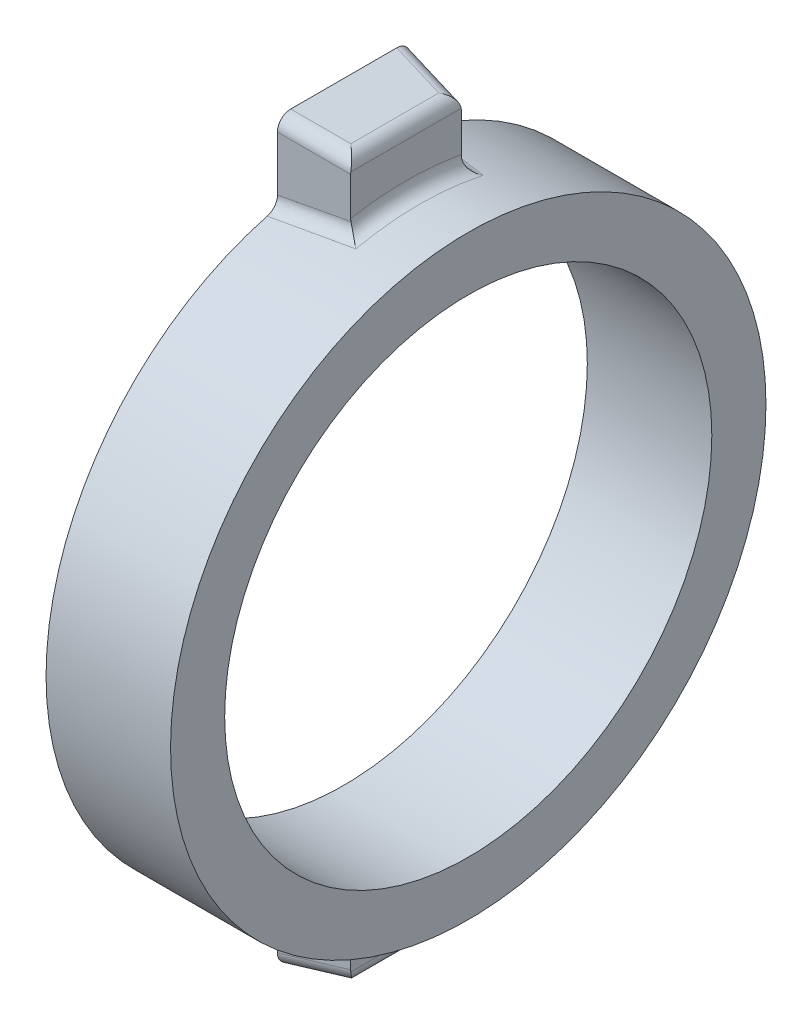
from build123d import *

# Parameters (mm, degrees)
SKETCH1_R                     = 11
SKETCH1_R_2                   = 9
BOSS_EXTRUDE1_DEPTH           = 4.6
SKETCH1_3_R                   = 11
SKETCH1_3_R_2                 = 9
BOSS_EXTRUDE2_DEPTH           = 4.6
BOSS_EXTRUDE3_DEPTH           = 2.3
BOSS_EXTRUDE3_DRAFT           = -10
BOSS_EXTRUDE3_PROFILE_2_DEPTH = 2.3
BOSS_EXTRUDE3_PROFILE_2_DRAFT = -10
FILLET1_R                     = 0.5


with BuildPart() as part:
    # Sketch1 → Boss-Extrude1 (new body)
    with BuildSketch(Plane.YZ):
        Circle(SKETCH1_R)
        Circle(SKETCH1_R_2, mode=Mode.SUBTRACT)
    extrude(amount=BOSS_EXTRUDE1_DEPTH)

    # Sketch1<3> → Boss-Extrude2 (add)
    with BuildSketch(Plane.YZ):
        Circle(SKETCH1_3_R)
        Circle(SKETCH1_3_R_2, mode=Mode.SUBTRACT)
    extrude(amount=BOSS_EXTRUDE2_DEPTH)


with BuildPart() as boss_extrude3_tool:
    # Sketch2 → Boss-Extrude3 (with draft: the straight prism first)
    with BuildSketch(Plane(origin=(0, 0, 0), x_dir=(0, -1, 0), z_dir=(-1, 0, 0))):
        with BuildLine():
            Line((-13.623688731, -2.45), (-10.723688731, -2.45))
            Line((-10.723688731, -2.45), (-8.660109699, -2.45))
            ThreePointArc((-8.660109699, -2.45), (-9, 0), (-8.660109699, 2.45))
            Line((-8.660109699, 2.45), (-10.723688731, 2.45))
            Line((-10.723688731, 2.45), (-13.623688731, 2.45))
            Line((-13.623688731, 2.45), (-13.623688731, -2.45))
        make_face()
    extrude(amount=-BOSS_EXTRUDE3_DEPTH)
    # Boss-Extrude3: the draft: its side faces are tilted about the plane it starts from
    boss_extrude3_sides = [boss_extrude3_tool.faces().sort_by_distance(p)[0] for p in [
        (1.15, 11.141899215, -2.45),
        (1.15, 11.141899215, 2.45),
        (1.15, 9, 0),
        (1.15, 13.623688731, 0),
    ]]
    draft(boss_extrude3_sides, Plane(origin=(0, 0, 0), x_dir=(0, -1, 0), z_dir=(-1, 0, 0)), BOSS_EXTRUDE3_DRAFT)


with BuildPart() as part_1:
    add(part.part)

    # Boss-Extrude3: add boss_extrude3_tool
    add(boss_extrude3_tool.part)


with BuildPart() as boss_extrude3_profile_2_tool:
    # Sketch2 → Boss-Extrude3 profile 2 (with draft: the straight prism first)
    with BuildSketch(Plane(origin=(0, 0, 0), x_dir=(0, -1, 0), z_dir=(-1, 0, 0))):
        with BuildLine():
            Line((10.723688731, -2.45), (13.623688731, -2.45))
            Line((13.623688731, -2.45), (13.623688731, 2.45))
            Line((13.623688731, 2.45), (10.723688731, 2.45))
            Line((10.723688731, 2.45), (8.660109699, 2.45))
            ThreePointArc((8.660109699, 2.45), (9, 0), (8.660109699, -2.45))
            Line((8.660109699, -2.45), (10.723688731, -2.45))
        make_face()
    extrude(amount=-BOSS_EXTRUDE3_PROFILE_2_DEPTH)
    # Boss-Extrude3 profile 2: the draft: its side faces are tilted about the plane it starts from
    boss_extrude3_profile_2_sides = [boss_extrude3_profile_2_tool.faces().sort_by_distance(p)[0] for p in [
        (1.15, -11.141899215, -2.45),
        (1.15, -11.141899215, 2.45),
        (1.15, -13.623688731, 0),
        (1.15, -9, 0),
    ]]
    draft(boss_extrude3_profile_2_sides, Plane(origin=(0, 0, 0), x_dir=(0, -1, 0), z_dir=(-1, 0, 0)), BOSS_EXTRUDE3_PROFILE_2_DRAFT)


with BuildPart() as part_2:
    add(part_1.part)

    # Boss-Extrude3 profile 2: add boss_extrude3_profile_2_tool
    add(boss_extrude3_profile_2_tool.part)

    # Fillet1
    fillet1_edges = [part_2.edges().sort_by_distance(p)[0] for p in [
        (1.149928959, -10.768004835, 2.247236499),
        (2.3, -13.218136675, 0),
        (1.15, -13.420912703, 2.247223972),
        (1.15, -13.420912703, -2.247223972),
        (1.149928959, -10.768004835, -2.247236499),
        (2.3, -11, 0),
        (1.15, 13.420912703, 2.247223972),
        (1.15, 13.420912703, -2.247223972),
        (1.149928959, 10.768004835, -2.247236499),
        (1.149928959, 10.768004835, 2.247236499),
        (2.3, 13.218136675, 0),
        (2.3, 10.951980407, -1.026705972),
    ]]
    fillet(fillet1_edges, radius=FILLET1_R)


solid = part_2.part
